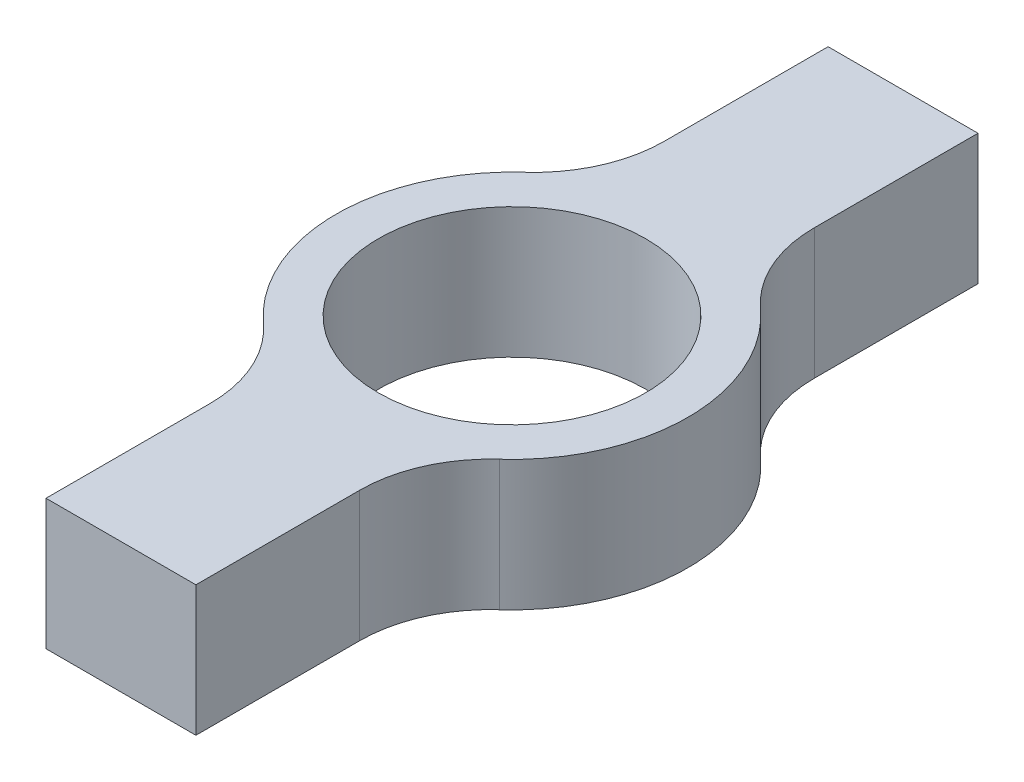
from build123d import *

# Parameters (mm, degrees)
SKETCH_1_R          = 13.5
EXTRUDE_1_DEPTH     = 10
SKETCH_2_W          = 11.5
SKETCH_2_H          = 60
EXTRUDE_2_DEPTH     = 10
SKETCH_3_R          = 10.25
CUT_EXTRUDE_1_DEPTH = 10
FILLET_1_R          = 10


with BuildPart() as part:
    # 草图1 → 凸台-拉伸1 (new body)
    with BuildSketch(Plane(origin=(0, 0, 0), x_dir=(1, 0, 0), z_dir=(0, 1, 0))):
        with Locations(Location((0, 0, 0), (0, 0, 270))):
            Circle(SKETCH_1_R)
    extrude(amount=EXTRUDE_1_DEPTH)

    # 草图2 → 凸台-拉伸2 (add)
    with BuildSketch(Plane(origin=(0, 10, 0), x_dir=(1, 0, 0), z_dir=(0, 1, 0))):
        Rectangle(SKETCH_2_W, SKETCH_2_H)
    extrude(amount=-EXTRUDE_2_DEPTH)

    # 草图3 → 切除-拉伸1 (cut)
    with BuildSketch(Plane(origin=(0, 10, 0), x_dir=(1, 0, 0), z_dir=(0, 1, 0))):
        with Locations(Location((0, 0, 0), (0, 0, 270))):
            Circle(SKETCH_3_R)
    extrude(amount=-CUT_EXTRUDE_1_DEPTH, mode=Mode.SUBTRACT)

    # 圆角1
    fillet_1_edges = [part.edges().sort_by_distance(p)[0] for p in [
        (-5.75, 5, -12.2142335),
        (-5.75, 5, 12.2142335),
        (5.75, 5, 12.2142335),
        (5.75, 5, -12.2142335),
    ]]
    fillet(fillet_1_edges, radius=FILLET_1_R)


solid = part.part
